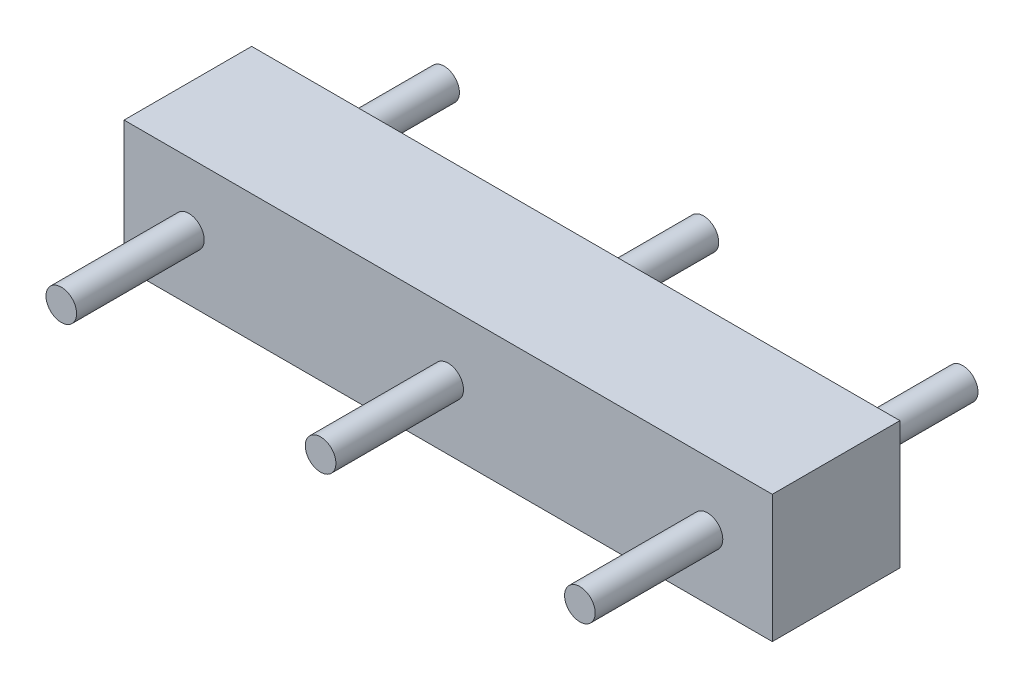
from build123d import *

# Parameters (mm, degrees)
SKETCH_1_W                 = 12.7
SKETCH_1_H                 = 2.5
EXTRUDE_1_DEPTH            = 2.5
EXTRUDE_START              = -5
SKETCH_2_R                 = 0.3
EXTRUDE_2_DEPTH            = 7.5
PATTERN_LINEAR_1_COUNT     = 2
PATTERN_LINEAR_1_PITCH     = 5.08
PATTERN_LINEAR_1_COL_COUNT = 2
PATTERN_LINEAR_1_COL_PITCH = 5.08


with BuildPart() as part:
    # 草图1 → 凸台-拉伸1 (new body)
    with BuildSketch(Plane.XY):
        with Locations((6.35, 1.25)):
            Rectangle(SKETCH_1_W, SKETCH_1_H)
    extrude(amount=EXTRUDE_1_DEPTH)

    # 草图2 → 凸台-拉伸2 (add)
    with BuildSketch(Plane.XY.offset(2.5).offset(EXTRUDE_START)):
        with Locations((6.35, 1.25)):
            Circle(SKETCH_2_R)
    extrude_2 = extrude(amount=EXTRUDE_2_DEPTH)

    # 阵列(线性)1: 凸台-拉伸2 ×2
    with Locations(*[(i * PATTERN_LINEAR_1_PITCH, 0, 0) for i in range(1, PATTERN_LINEAR_1_COUNT)]):
        add(extrude_2)

    # 阵列(线性)1 col: 凸台-拉伸2 ×2
    with Locations(*[(-i * PATTERN_LINEAR_1_COL_PITCH, 0, 0) for i in range(1, PATTERN_LINEAR_1_COL_COUNT)]):
        add(extrude_2)


solid = part.part
